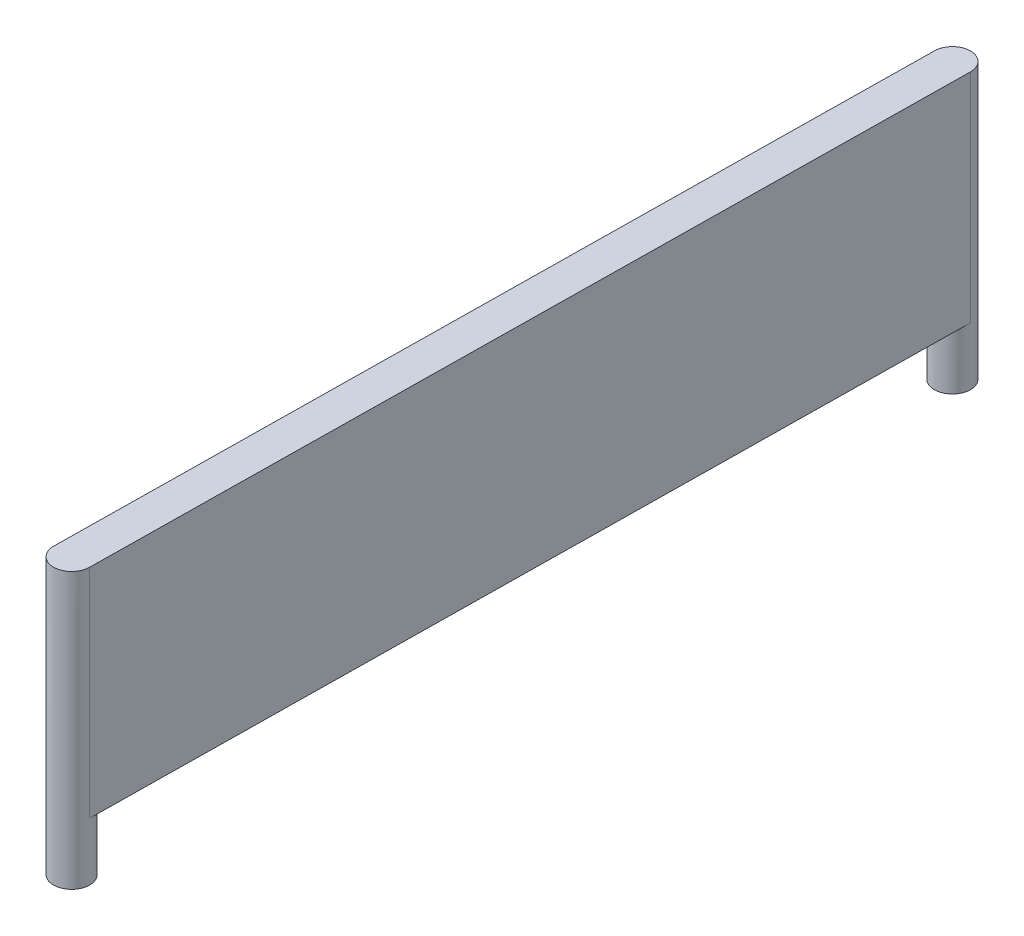
from build123d import *

# Parameters (mm, degrees)
BOSS_EXTRUDE1_DEPTH = 38.1
BOSS_EXTRUDE2_START = 10.16
SKETCH2_R           = 3.175
BOSS_EXTRUDE2_DEPTH = 10.16


with BuildPart() as part:
    # Sketch1 → Boss-Extrude1 (new body)
    with BuildSketch(Plane(origin=(0, 0, 0), x_dir=(1, 0, 0), z_dir=(0, 1, 0))):
        with BuildLine():
            Line((-3.174725922, 0.04171715), (-1.172129839, 152.44171715))
            ThreePointArc((-1.172129839, 152.44171715), (2.044313233, 155.574725922), (5.177322005, 152.35828285))
            Line((5.177322005, 152.35828285), (3.174725922, -0.04171715))
            ThreePointArc((3.174725922, -0.04171715), (-0.04171715, -3.174725922), (-3.174725922, 0.04171715))
        make_face()
    extrude(amount=BOSS_EXTRUDE1_DEPTH)

    # Sketch2 → Boss-Extrude2 (add)
    with BuildSketch(Plane(origin=(0, 0, 0), x_dir=(-1, 0, 0), z_dir=(0, -1, 0)).offset(BOSS_EXTRUDE2_START)):
        with Locations(Location((-2.002596083, 152.4, 0), (0, 0, 90))):
            Circle(SKETCH2_R)
        with Locations(Location((0, 0, 0), (0, 0, 90))):
            Circle(SKETCH2_R)
    extrude(amount=-BOSS_EXTRUDE2_DEPTH)


solid = part.part
